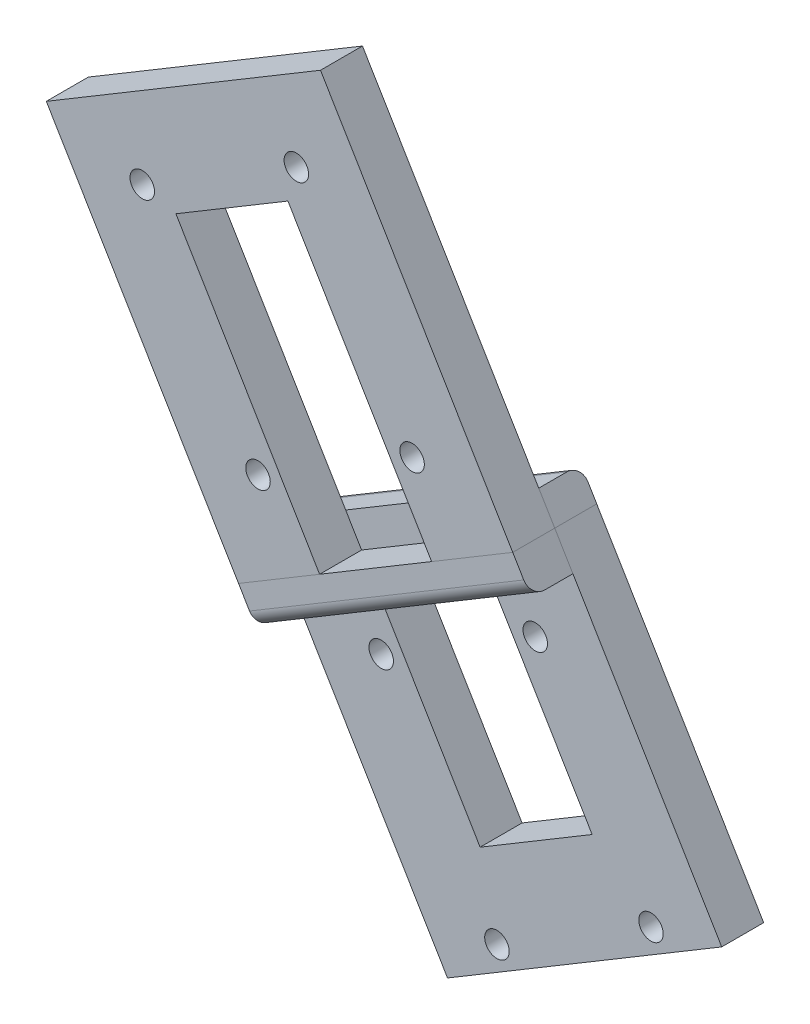
from build123d import *

# Parameters (mm, degrees)
SKETCH_2_R         = 1.75
EXTRUDE_1_DEPTH    = 6
SKETCH_3_R         = 1.75
EXTRUDE_2_DEPTH    = 6
EXTRUDE_17_DEPTH   = 45.651510747
EXTRUDE_17_2_DEPTH = 45.651510747


with BuildPart() as part:
    # 草图2 → 凸台-拉伸1 (new body)
    # profile 1 of 3: a face of its own
    with BuildSketch(Plane.XY):
        with BuildLine():
            Line((-73.427324865, 51.706126211), (-55.889337921, 22.385784607))
            ThreePointArc((-55.889337921, 22.385784607), (-51.962002674, 21.977062419), (-48.013570238, 22.007016762))
            ThreePointArc((-48.013570238, 22.007016762), (-46.613378868, 21.552890348), (-45.90320467, 20.263541953))
            ThreePointArc((-45.90320467, 20.263541953), (-42.655905931, 17.91025531), (-40.513003789, 21.300075002))
            ThreePointArc((-40.513003789, 21.300075002), (-40.566074024, 22.008719301), (-40.368008135, 22.691187687))
            ThreePointArc((-40.368008135, 22.691187687), (-40.361958472, 22.703470869), (-40.355993042, 22.71579518))
            Line((-40.355993042, 22.71579518), (-54.911886597, 47.050616088))
            Line((-54.911886597, 47.050616088), (-38.905429945, 56.625176062))
            Line((-38.905429945, 56.625176062), (-24.34928893, 32.289941443))
            ThreePointArc((-24.34928893, 32.289941443), (-24.335603169, 32.289367496), (-24.321913798, 32.288887294))
            ThreePointArc((-24.321913798, 32.288887294), (-23.626933575, 32.140579674), (-23.027680881, 31.758625659))
            ThreePointArc((-23.027680881, 31.758625659), (-19.027440456, 32.043222354), (-19.564814907, 36.017407483))
            ThreePointArc((-19.564814907, 36.017407483), (-20.364881109, 37.252986699), (-20.102685981, 38.701439544))
            ThreePointArc((-20.102685981, 38.701439544), (-18.20870194, 42.16593888), (-16.711167613, 45.819337591))
            Line((-16.711167613, 45.819337591), (-34.249858882, 75.140856698))
            Line((-34.249858882, 75.140856698), (-73.427324865, 51.706126211))
        make_face()
        with Locations((-43.175214984, 20.610777132)):
            Circle(SKETCH_2_R, mode=Mode.SUBTRACT)
        with Locations((-59.712185407, 48.257600194)):
            Circle(SKETCH_2_R, mode=Mode.SUBTRACT)
        with Locations((-37.69843004, 61.425537708)):
            Circle(SKETCH_2_R, mode=Mode.SUBTRACT)
        with Locations((-21.161114888, 33.778138323)):
            Circle(SKETCH_2_R, mode=Mode.SUBTRACT)
    # profile 2 of 3: a face of its own
    with BuildSketch(Plane.XY):
        with BuildLine():
            Line((-18.364250903, 22.284040537), (-6.778655524, 29.213974138))
            Line((-6.778655524, 29.213974138), (-16.711167613, 45.819337591))
            ThreePointArc((-16.711167613, 45.819337591), (-18.20870194, 42.16593888), (-20.102685981, 38.701439544))
            ThreePointArc((-20.102685981, 38.701439544), (-20.364881109, 37.252986699), (-19.564814907, 36.017407483))
            ThreePointArc((-19.564814907, 36.017407483), (-19.027440456, 32.043222354), (-23.027680881, 31.758625659))
            ThreePointArc((-23.027680881, 31.758625659), (-23.626933575, 32.140579674), (-24.321913798, 32.288887294))
            ThreePointArc((-24.321913798, 32.288887294), (-24.335603169, 32.289367496), (-24.34928893, 32.289941443))
            Line((-24.34928893, 32.289941443), (-18.364250903, 22.284040537))
        make_face()
    # profile 3 of 3: a face of its own
    with BuildSketch(Plane.XY):
        with BuildLine():
            Line((-55.889337921, 22.385784607), (-45.956428261, 5.779756487))
            Line((-45.956428261, 5.779756487), (-34.370832882, 12.709690089))
            Line((-34.370832882, 12.709690089), (-40.355993042, 22.71579518))
            ThreePointArc((-40.355993042, 22.71579518), (-40.361958472, 22.703470869), (-40.368008135, 22.691187687))
            ThreePointArc((-40.368008135, 22.691187687), (-40.566074024, 22.008719301), (-40.513003789, 21.300075002))
            ThreePointArc((-40.513003789, 21.300075002), (-42.655905931, 17.91025531), (-45.90320467, 20.263541953))
            ThreePointArc((-45.90320467, 20.263541953), (-46.613378868, 21.552890348), (-48.013570238, 22.007016762))
            ThreePointArc((-48.013570238, 22.007016762), (-51.962002674, 21.977062419), (-55.889337921, 22.385784607))
        make_face()
    extrude(amount=EXTRUDE_1_DEPTH)


with BuildPart() as body_2:
    # 草图3 → 凸台-拉伸2 (new body)
    with BuildSketch(Plane(origin=(0, 0, 0), x_dir=(-1, 0, 0), z_dir=(0, 0, -1))):
        Polygon((45.956428261, 5.779756487), (34.370832882, 12.709690089), (17.438912308, -15.59741818), (1.432455657, -6.022858206), (18.364250903, 22.284040537), (6.778655524, 29.213974138), (-17.082982611, -10.678368329), (22.094483372, -34.113098816), align=None)
        with Locations((-6.977273986, -13.26415773)):
            Circle(SKETCH_3_R, mode=Mode.SUBTRACT)
        with Locations((15.036826109, -26.431518921)):
            Circle(SKETCH_3_R, mode=Mode.SUBTRACT)
        with Locations((9.560041165, 14.383241655)):
            Circle(SKETCH_3_R, mode=Mode.SUBTRACT)
        with Locations((31.573796532, 1.215304141)):
            Circle(SKETCH_3_R, mode=Mode.SUBTRACT)
    extrude(amount=EXTRUDE_2_DEPTH)


with BuildPart() as body_3:
    # 草图4 → 凸台-拉伸17 (new body)
    with BuildSketch(Plane(origin=(7.877323837, 4.711827866, 0), x_dir=(0, 0, -1), z_dir=(0.8581922502720695, 0.5133284149284565, 0))):
        with BuildLine():
            Line((0, 32.992326526), (0, 28.550882701))
            Line((0, 28.550882701), (6, 28.550882701))
            Line((6, 28.550882701), (6, 30.992326526))
            ThreePointArc((6, 30.992326526), (5.414213562, 32.406540088), (4, 32.992326526))
            Line((4, 32.992326526), (0, 32.992326526))
        make_face()
    extrude(amount=-EXTRUDE_17_DEPTH)


with BuildPart() as body_4:
    # 草图4 → Extrude 17 2 (new body)
    with BuildSketch(Plane(origin=(7.877323837, 4.711827866, 0), x_dir=(0, 0, -1), z_dir=(0.8581922502720695, 0.5133284149284565, 0))):
        with BuildLine():
            Line((0, 23.490400466), (0, 28.550882701))
            Line((0, 28.550882701), (-6, 28.550882701))
            Line((-6, 28.550882701), (-6, 25.490400466))
            ThreePointArc((-6, 25.490400466), (-5.414213562, 24.076186903), (-4, 23.490400466))
            Line((-4, 23.490400466), (0, 23.490400466))
        make_face()
    extrude(amount=-EXTRUDE_17_2_DEPTH)


solid = Compound([part.part, body_2.part, body_3.part, body_4.part])
